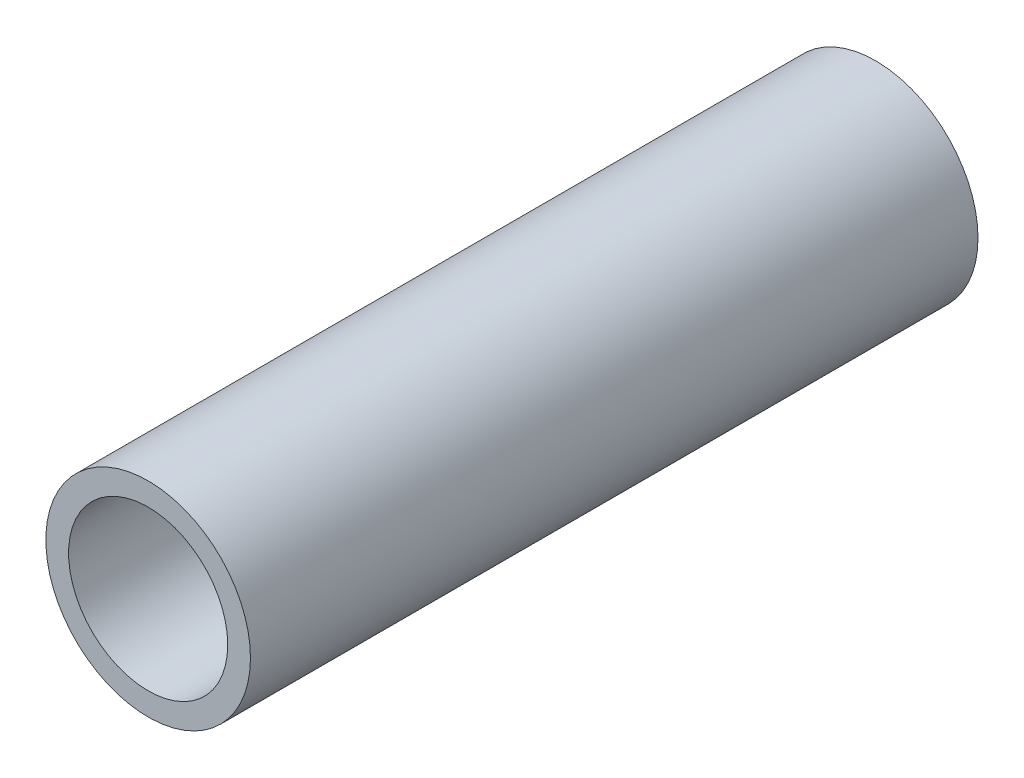
from build123d import *

# Parameters (mm, degrees)
ESQUISSE1_R          = 2.25
ESQUISSE1_R_2        = 1.75
BASE_EXTRUSION_DEPTH = 8


with BuildPart() as part:
    # Esquisse1 → Base-Extrusion (new, symmetric)
    with BuildSketch(Plane.XY):
        with Locations((0, 9)):
            Circle(ESQUISSE1_R)
        with Locations((0, 9)):
            Circle(ESQUISSE1_R_2, mode=Mode.SUBTRACT)
    extrude(amount=BASE_EXTRUSION_DEPTH, both=True)


solid = part.part
